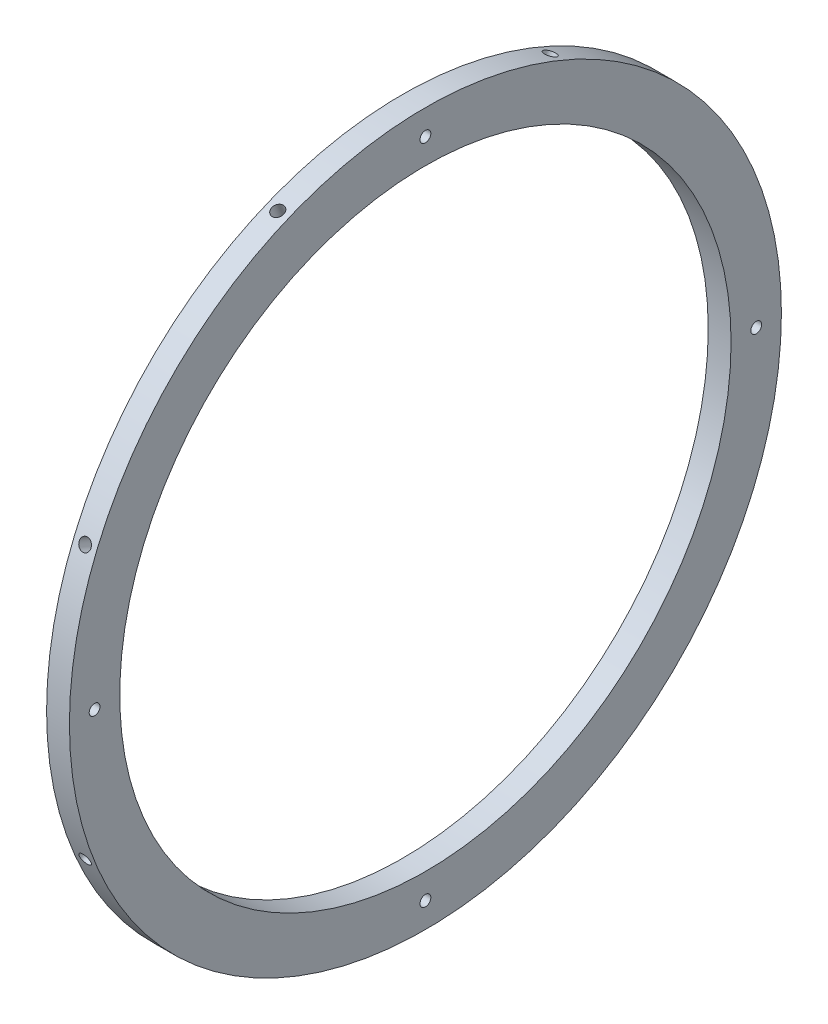
from build123d import *

# Parameters (mm, degrees)
RING_START                = 3.18
RING_SKETCH_R             = 99
RING_SKETCH_R_2           = 85
RING_SKETCH_R_3           = 1.5
RING_DEPTH                = 6.35
WALL_START                = -91
WALL_SCREW_HOLES_SKETCH_R = 1.65
WALL_SCREW_HOLES_DEPTH    = 9
WALL_SCREW_HOLES_X8_COUNT = 8


with BuildPart() as part:
    # Ring Sketch → Ring (new body)
    with BuildSketch(Plane(origin=(0, 0, 0), x_dir=(0, 0, -1), z_dir=(1, 0, 0)).offset(RING_START)):
        Circle(RING_SKETCH_R)
        Circle(RING_SKETCH_R_2, mode=Mode.SUBTRACT)
        with Locations((0, 92)):
            Circle(RING_SKETCH_R_3, mode=Mode.SUBTRACT)
        with Locations((-92, 0)):
            Circle(RING_SKETCH_R_3, mode=Mode.SUBTRACT)
        with Locations((0, -92)):
            Circle(RING_SKETCH_R_3, mode=Mode.SUBTRACT)
        with Locations((92, 0)):
            Circle(RING_SKETCH_R_3, mode=Mode.SUBTRACT)
    extrude(amount=RING_DEPTH)

    # Wall Screw Holes Sketch → Wall Screw Holes (cut)
    with BuildSketch(Plane(origin=(0, 0, 0), x_dir=(-1, 0, 0), z_dir=(0, -0.9238795325112867, -0.3826834323650897)).offset(WALL_START)):
        with Locations((-6.355, 0)):
            Circle(WALL_SCREW_HOLES_SKETCH_R)
    wall_screw_holes = extrude(amount=-WALL_SCREW_HOLES_DEPTH, mode=Mode.SUBTRACT)

    # Wall Screw Holes x8: Wall Screw Holes ×8 about axis
    wall_screw_holes_x8_axis = Axis((9.8475, 0, 0), (-1, 0, 0))
    for i in range(1, WALL_SCREW_HOLES_X8_COUNT):
        add(wall_screw_holes.rotate(wall_screw_holes_x8_axis, i * 360 / WALL_SCREW_HOLES_X8_COUNT), mode=Mode.SUBTRACT)


solid = part.part
